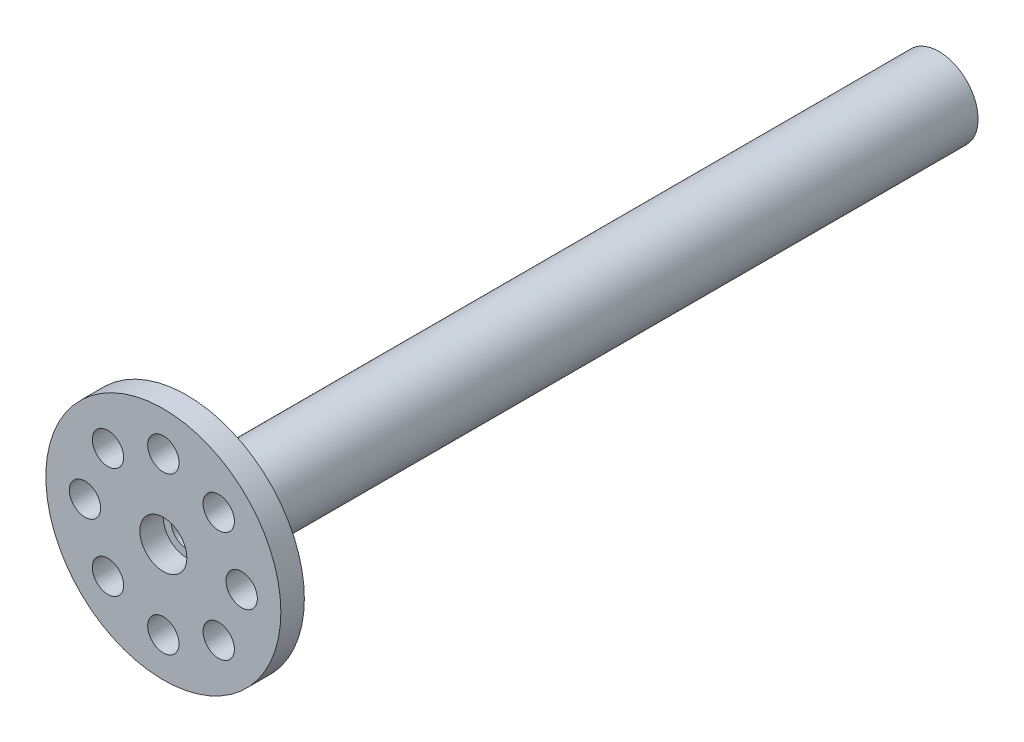
from build123d import *

# Parameters (mm, degrees)
SKETCH_1_R          = 5
EXTRUDE_1_DEPTH     = 93
SKETCH_2_R          = 6
EXTRUDE_2_DEPTH     = 3
SKETCH_3_R          = 15
SKETCH_3_R_2        = 2
EXTRUDE_3_DEPTH     = 3
SKETCH_6_R          = 2
CUT_EXTRUDE_3_DEPTH = 102.247222184
SKETCH_7_R          = 3
CUT_EXTRUDE_4_DEPTH = 3


with BuildPart() as part:
    # 草图1 → 凸台-拉伸1 (new body)
    with BuildSketch(Plane.XY):
        with Locations(Location((0, 0, 0), (0, 0, 180))):
            Circle(SKETCH_1_R)
    extrude(amount=EXTRUDE_1_DEPTH)

    # 草图2 → 凸台-拉伸2 (add)
    with BuildSketch(Plane.XY.offset(93)):
        Circle(SKETCH_2_R)
    extrude(amount=EXTRUDE_2_DEPTH)

    # 草图3 → 凸台-拉伸3 (add)
    with BuildSketch(Plane.XY.offset(96)):
        Circle(SKETCH_3_R)
        with Locations((0, 10)):
            Circle(SKETCH_3_R_2, mode=Mode.SUBTRACT)
        with Locations((10, 0)):
            Circle(SKETCH_3_R_2, mode=Mode.SUBTRACT)
        with Locations((0, -10)):
            Circle(SKETCH_3_R_2, mode=Mode.SUBTRACT)
        with Locations((-10, 0)):
            Circle(SKETCH_3_R_2, mode=Mode.SUBTRACT)
        with Locations((7.071067812, 7.071067812)):
            Circle(SKETCH_3_R_2, mode=Mode.SUBTRACT)
        with Locations((7.071067812, -7.071067812)):
            Circle(SKETCH_3_R_2, mode=Mode.SUBTRACT)
        with Locations((-7.071067812, -7.071067812)):
            Circle(SKETCH_3_R_2, mode=Mode.SUBTRACT)
        with Locations((-7.071067812, 7.071067812)):
            Circle(SKETCH_3_R_2, mode=Mode.SUBTRACT)
    extrude(amount=EXTRUDE_3_DEPTH)

    # 草图6 → 切除-拉伸3 (cut, through all)
    with BuildSketch(Plane(origin=(0, 0, 0), x_dir=(-1, 0, 0), z_dir=(0, 0, -1))):
        Circle(SKETCH_6_R)
    extrude(amount=-CUT_EXTRUDE_3_DEPTH, mode=Mode.SUBTRACT)

    # 草图7 → 切除-拉伸4 (cut)
    with BuildSketch(Plane.XY.offset(99)):
        Circle(SKETCH_7_R)
    extrude(amount=-CUT_EXTRUDE_4_DEPTH, mode=Mode.SUBTRACT)


solid = part.part
